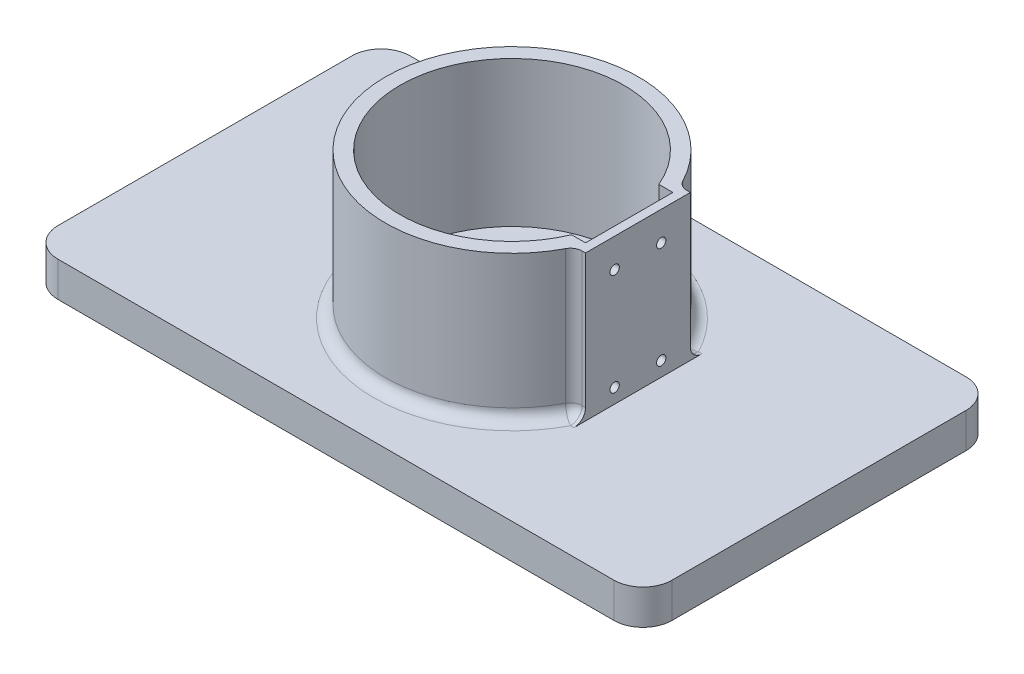
from build123d import *

# Parameters (mm, degrees)
SKETCH1_W           = 211
SKETCH1_H           = 121
BOSS_EXTRUDE1_DEPTH = 12
SKETCH2_W           = 201
SKETCH2_H           = 111
CUT_EXTRUDE1_DEPTH  = 7
SKETCH3_R           = 32
CUT_EXTRUDE2_DEPTH  = 244.52823245
BOSS_EXTRUDE2_DEPTH = 50
SKETCH5_R           = 1.6
CUT_EXTRUDE3_DEPTH  = 6
FILLET1_R           = 4
FILLET2_R           = 10


with BuildPart() as part:
    # Sketch1 → Boss-Extrude1 (new body)
    with BuildSketch(Plane(origin=(0, 0, 0), x_dir=(1, 0, 0), z_dir=(0, 1, 0))):
        with Locations((105.5, 60.5)):
            Rectangle(SKETCH1_W, SKETCH1_H)
    extrude(amount=BOSS_EXTRUDE1_DEPTH)

    # Sketch2 → Cut-Extrude1 (cut)
    with BuildSketch(Plane.XZ):
        with Locations((105.5, -60.5)):
            Rectangle(SKETCH2_W, SKETCH2_H)
    extrude(amount=-CUT_EXTRUDE1_DEPTH, mode=Mode.SUBTRACT)

    # Sketch3 → Cut-Extrude2 (cut, through all)
    with BuildSketch(Plane(origin=(0, 12, 0), x_dir=(1, 0, 0), z_dir=(0, 1, 0))):
        with Locations(Location((105.5, 60.5, 0), (0, 0, 270))):
            Circle(SKETCH3_R)
    extrude(amount=-CUT_EXTRUDE2_DEPTH, mode=Mode.SUBTRACT)

    # Sketch4 → Boss-Extrude2 (add)
    with BuildSketch(Plane(origin=(0, 12, 0), x_dir=(1, 0, 0), z_dir=(0, 1, 0))):
        with BuildLine():
            ThreePointArc((140.957721303, 45.5), (67, 60.5), (140.957721303, 75.5))
            Line((140.957721303, 75.5), (145.775366264, 75.5))
            Line((145.775366264, 75.5), (146.331972766, 75.5))
            ThreePointArc((146.331972766, 75.5), (145.74451839, 77.011472968), (145.101136347, 78.5))
            ThreePointArc((145.101136347, 78.5), (62, 60.5), (145.101136347, 42.5))
            ThreePointArc((145.101136347, 42.5), (145.74451839, 43.988527032), (146.331972766, 45.5))
            Line((146.331972766, 45.5), (145.775366264, 45.5))
            Line((145.775366264, 45.5), (140.957721303, 45.5))
        make_face()
        with BuildLine():
            Line((146.331972766, 75.5), (145.775366264, 75.5))
            Line((145.775366264, 75.5), (145.775366264, 45.5))
            Line((145.775366264, 45.5), (146.331972766, 45.5))
            ThreePointArc((146.331972766, 45.5), (147.885391427, 50.715900981), (148.775366264, 56.084949069))
            Line((148.775366264, 56.084949069), (148.775366264, 64.915050931))
            ThreePointArc((148.775366264, 64.915050931), (147.885391427, 70.284099019), (146.331972766, 75.5))
        make_face()
        with BuildLine():
            ThreePointArc((145.101136347, 78.5), (145.74451839, 77.011472968), (146.331972766, 75.5))
            Line((146.331972766, 75.5), (148.775366264, 75.5))
            Line((148.775366264, 75.5), (148.775366264, 78.5))
            Line((148.775366264, 78.5), (145.101136347, 78.5))
        make_face()
        with BuildLine():
            Line((148.775366264, 75.5), (146.331972766, 75.5))
            ThreePointArc((146.331972766, 75.5), (147.885391427, 70.284099019), (148.775366264, 64.915050931))
            Line((148.775366264, 64.915050931), (148.775366264, 75.5))
        make_face()
        with BuildLine():
            ThreePointArc((148.775366264, 56.084949069), (147.885391427, 50.715900981), (146.331972766, 45.5))
            Line((146.331972766, 45.5), (148.775366264, 45.5))
            Line((148.775366264, 45.5), (148.775366264, 56.084949069))
        make_face()
        with BuildLine():
            Line((148.775366264, 45.5), (146.331972766, 45.5))
            ThreePointArc((146.331972766, 45.5), (145.74451839, 43.988527032), (145.101136347, 42.5))
            Line((145.101136347, 42.5), (148.775366264, 42.5))
            Line((148.775366264, 42.5), (148.775366264, 45.5))
        make_face()
    extrude(amount=BOSS_EXTRUDE2_DEPTH)

    # Sketch5 → Cut-Extrude3 (cut)
    with BuildSketch(Plane(origin=(148.775366264, 0, 0), x_dir=(0, 0, -1), z_dir=(1, 0, 0))):
        with Locations((52.5, 52)):
            Circle(SKETCH5_R)
        with Locations((68.5, 52)):
            Circle(SKETCH5_R)
        with Locations((68.5, 17)):
            Circle(SKETCH5_R)
        with Locations((52.5, 17)):
            Circle(SKETCH5_R)
    extrude(amount=-CUT_EXTRUDE3_DEPTH, mode=Mode.SUBTRACT)

    # Fillet1
    fillet1_edges = [part.edges().sort_by_distance(p)[0] for p in [
        (146.938251306, 12, -42.5),
        (145.101136347, 37, -42.5),
        (62, 12, -60.5),
        (145.101136347, 37, -78.5),
        (146.938251306, 12, -78.5),
    ]]
    fillet(fillet1_edges, radius=FILLET1_R)

    # Fillet2
    fillet2_edges = [part.edges().sort_by_distance(p)[0] for p in [
        (5, 3.5, -116),
        (5, 3.5, -5),
        (206, 3.5, -5),
        (206, 3.5, -116),
        (0, 6, -121),
        (211, 6, -121),
        (211, 6, 0),
        (0, 6, 0),
    ]]
    fillet(fillet2_edges, radius=FILLET2_R)


solid = part.part
